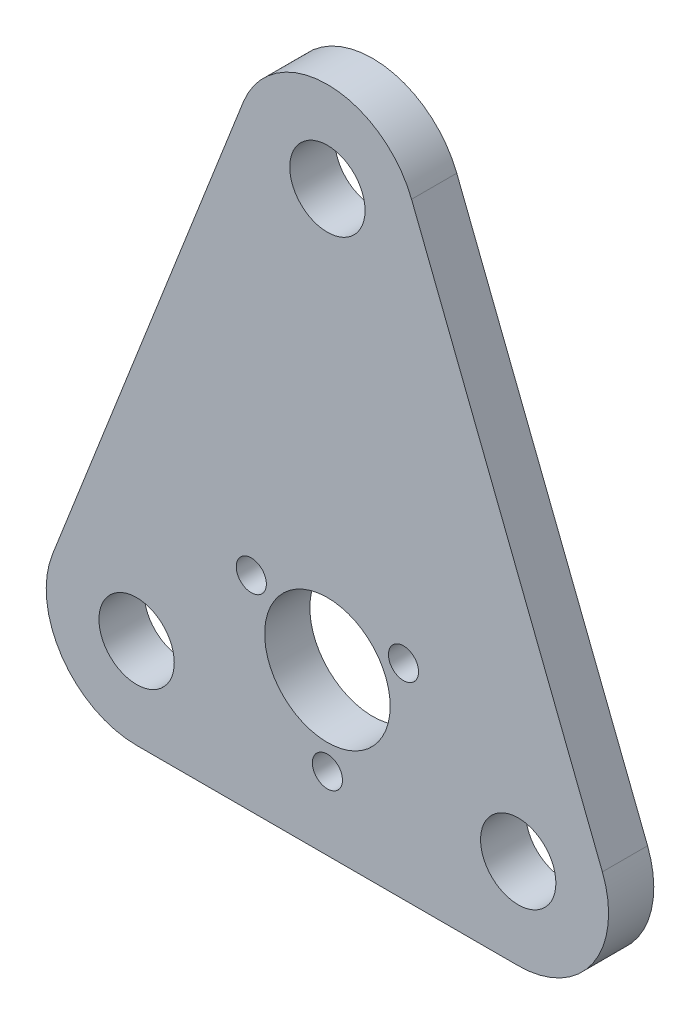
from build123d import *

# Parameters (mm, degrees)
ESBO_O1_R                = 12.5
ESBO_O1_R_2              = 7.5
ESBO_O1_R_3              = 3
RESSALTO_EXTRUS_O2_DEPTH = 4.5


with BuildPart() as part:
    # Esboço1 → Ressalto-extrusão2 (new, symmetric)
    with BuildSketch(Plane.XY):
        with BuildLine():
            Line((-16.759819531, 89.565702497), (-54.759819531, -7.434297503))
            ThreePointArc((-54.759819531, -7.434297503), (-52.869139937, -24.144391432), (-38, -32))
            Line((-38, -32), (38, -32))
            ThreePointArc((38, -32), (52.869139937, -24.144391432), (54.759819531, -7.434297503))
            Line((54.759819531, -7.434297503), (16.759819531, 89.565702497))
            ThreePointArc((16.759819531, 89.565702497), (0, 101), (-16.759819531, 89.565702497))
        make_face()
        Circle(ESBO_O1_R, mode=Mode.SUBTRACT)
        with Locations((0, 83)):
            Circle(ESBO_O1_R_2, mode=Mode.SUBTRACT)
        with Locations((38, -14)):
            Circle(ESBO_O1_R_2, mode=Mode.SUBTRACT)
        with Locations((-38, -14)):
            Circle(ESBO_O1_R_2, mode=Mode.SUBTRACT)
        with Locations((0, -17.5)):
            Circle(ESBO_O1_R_3, mode=Mode.SUBTRACT)
        with Locations((15.155444566, 8.75)):
            Circle(ESBO_O1_R_3, mode=Mode.SUBTRACT)
        with Locations((-15.155444566, 8.75)):
            Circle(ESBO_O1_R_3, mode=Mode.SUBTRACT)
    extrude(amount=RESSALTO_EXTRUS_O2_DEPTH, both=True)


solid = part.part
